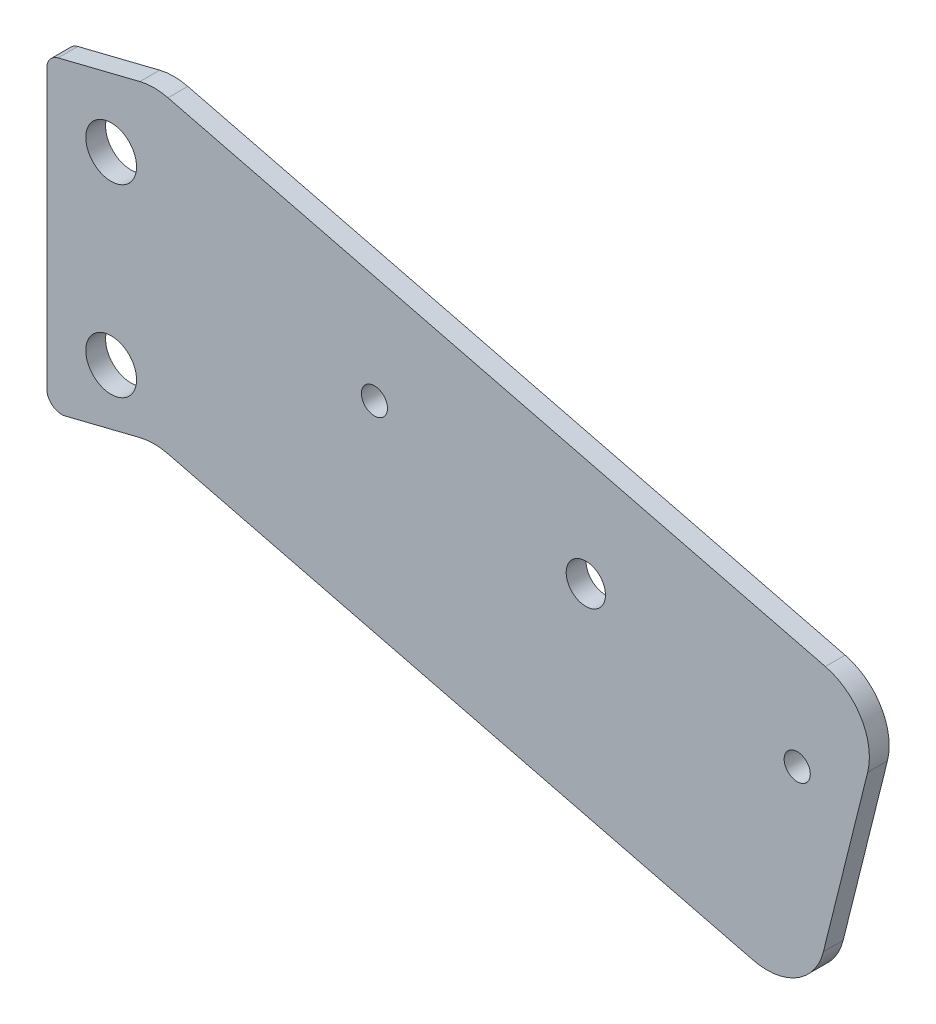
from build123d import *

# Parameters (mm, degrees)
BOSS_EXTRUDE1_DEPTH             = 3.4036
F_1_4_CLEARANCE_HOLE1_D         = 6.7564
M4_CLEARANCE_HOLE1_D            = 4.5
HOLE_FOR_1_4_300_SC_NUTS_SP_1_D = 8.7376


with BuildPart() as part:
    # Sketch1 → Boss-Extrude1 (new body)
    with BuildSketch(Plane.XY):
        with BuildLine():
            Line((-16.513283012, -20.349388536), (-2.419218956, -16.835343693))
            ThreePointArc((-2.419218956, -16.835343693), (0, -16.538300956), (2.419218956, -16.835343693))
            Line((2.419218956, -16.835343693), (115.560967743, -45.044749956))
            ThreePointArc((115.560967743, -45.044749956), (121.713421794, -49.59732647), (122.84470605, -57.166926175))
            Line((122.84470605, -57.166926175), (115.224166338, -87.731241553))
            ThreePointArc((115.224166338, -87.731241553), (110.671589825, -93.883695604), (103.101990119, -95.014979859))
            Line((103.101990119, -95.014979859), (2.419218956, -69.911945605))
            ThreePointArc((2.419218956, -69.911945605), (0, -69.614902867), (-2.419218956, -69.911945605))
            Line((-2.419218956, -69.911945605), (-15.284319782, -73.1195755))
            ThreePointArc((-15.284319782, -73.1195755), (-17.462581544, -72.656571669), (-18.438801397, -70.655024355))
            Line((-18.438801397, -70.655024355), (-18.438801397, -22.813939681))
            ThreePointArc((-18.438801397, -22.813939681), (-17.900348711, -21.250159533), (-16.513283012, -20.349388536))
        make_face()
    extrude(amount=-BOSS_EXTRUDE1_DEPTH)

    # 1/4 Clearance Hole1 (through all)
    with Locations(Plane.XY):
        with Locations((74.335136024, -53.317040996)):
            Hole(F_1_4_CLEARANCE_HOLE1_D / 2)

    # M4 Clearance Hole1 (through all)
    with Locations(Plane.XY):
        with Locations((37.949046288, -44.244969911), (110.721225759, -62.389112081)):
            Hole(M4_CLEARANCE_HOLE1_D / 2)

    # Hole for 1/4 300® SC Nuts (SP)1 (through all)
    with Locations(Plane.XY):
        with Locations((-7.366, -61.569560235), (-7.366, -29.819560235)):
            Hole(HOLE_FOR_1_4_300_SC_NUTS_SP_1_D / 2)


solid = part.part
